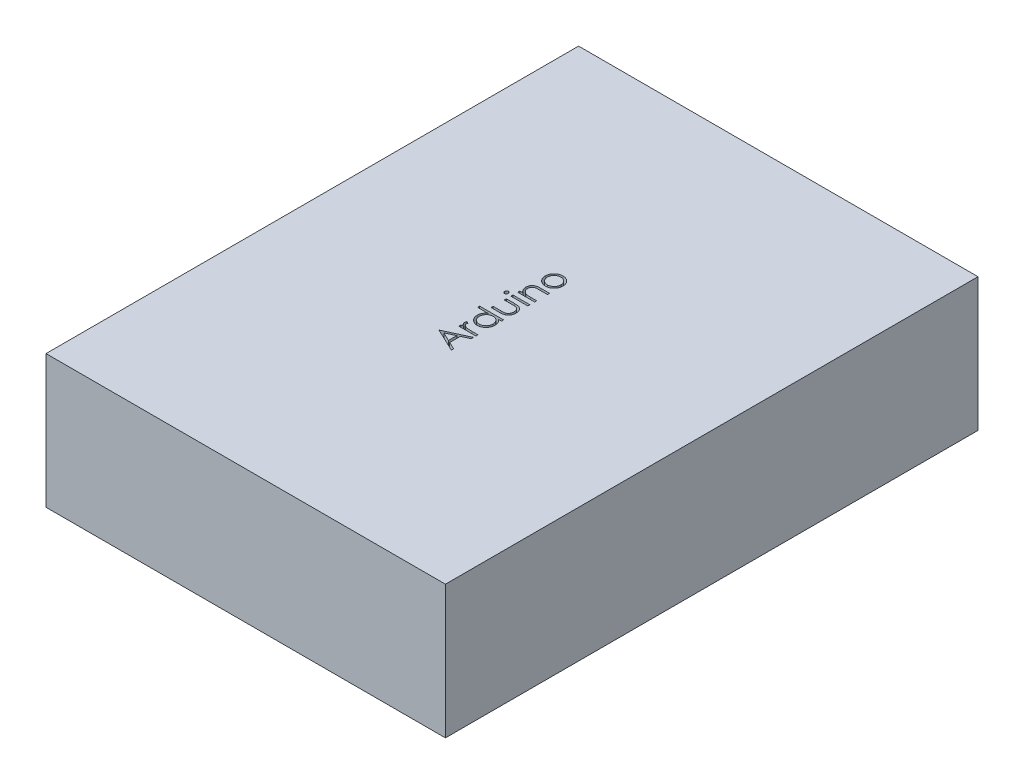
from build123d import *

# Parameters (mm, degrees)
SKETCH1_W           = 60
SKETCH1_H           = 80
BOSS_EXTRUDE1_DEPTH = 20
SKETCH2_W           = 2.557692308
SKETCH2_H           = 0.314102564
CUT_EXTRUDE1_DEPTH  = 2


with BuildPart() as part:
    # Sketch1 → Boss-Extrude1 (new body)
    with BuildSketch(Plane(origin=(0, 0, 0), x_dir=(1, 0, 0), z_dir=(0, 1, 0))):
        Rectangle(SKETCH1_W, SKETCH1_H)
    extrude(amount=BOSS_EXTRUDE1_DEPTH)

    # Sketch2 → Cut-Extrude1 (cut)
    # profile 1 of 8: a face of its own
    with BuildSketch(Plane(origin=(0, 20, 0), x_dir=(1, 0, 0), z_dir=(0, 1, 0))):
        Polygon((-3.5, -7.403846154), (0, -5.788461538), (0, -6.129907853), (-1.121794872, -6.647335737), (-1.121794872, -8.233974359), (0, -8.766125801), (0, -9.108974359), (-3.5, -7.448717949), align=None)
        Polygon((-2.817808494, -7.42978766), (-1.480769231, -8.063601763), (-1.480769231, -6.812800481), align=None, mode=Mode.SUBTRACT)
    # profile 2 of 8: a face of its own
    with BuildSketch(Plane(origin=(0, 20, 0), x_dir=(1, 0, 0), z_dir=(0, 1, 0))):
        with BuildLine():
            Line((-2.557692308, -5.429487179), (-2.557692308, -5.115384615))
            Line((-2.557692308, -5.115384615), (-2.181189904, -5.115384615))
            add(Edge.make_bspline(
                [(-2.181189904, -5.115384615), (-2.216261426, -5.092210694), (-2.283335439, -5.047890749), (-2.371926058, -4.973880931), (-2.446113212, -4.898881357), (-2.504482141, -4.820922676), (-2.548594798, -4.74076921), (-2.57959138, -4.659096853), (-2.598813304, -4.575705887), (-2.601312162, -4.519530425), (-2.602564103, -4.491386218)],
                knots=[0, 0, 0, 0, 1.280091057, 2.448164201, 3.510831157, 4.48793739, 5.405868014, 6.289422536, 7.142991551, 8, 8, 8, 8], degree=3))
            add(Edge.make_bspline(
                [(-2.602564103, -4.491386218), (-2.601373576, -4.469559891), (-2.59892399, -4.424650806), (-2.581713165, -4.356668216), (-2.554235143, -4.286624765), (-2.52839492, -4.241482377), (-2.514923878, -4.217948718)],
                knots=[0, 0, 0, 0, 0.901110191, 1.854092781, 2.881294221, 4, 4, 4, 4], degree=3))
            Line((-2.514923878, -4.217948718), (-2.242888622, -4.390424679))
            add(Edge.make_bspline(
                [(-2.242888622, -4.390424679), (-2.249628888, -4.405533701), (-2.262423203, -4.434213515), (-2.277565213, -4.476168081), (-2.286481129, -4.514849418), (-2.287831847, -4.539492977), (-2.288461538, -4.550981571)],
                knots=[0, 0, 0, 0, 1.180555205, 2.24091978, 3.179933427, 4, 4, 4, 4], degree=3))
            add(Edge.make_bspline(
                [(-2.288461538, -4.550981571), (-2.286794658, -4.576194872), (-2.283394705, -4.627622697), (-2.256284039, -4.702874031), (-2.213741221, -4.776549406), (-2.165297528, -4.83449764), (-2.118763125, -4.879524504), (-2.078035261, -4.911906683), (-2.031944456, -4.94097017), (-1.982272224, -4.969162524), (-1.927771932, -4.99535535), (-1.868354671, -5.018762487), (-1.804511084, -5.040652667), (-1.76011915, -5.052980207), (-1.737379808, -5.059294872)],
                knots=[0, 0, 0, 0, 1.125322384, 2.295331465, 3.535939348, 4.916963136, 5.656144286, 6.429838446, 7.238666481, 8.090384391, 8.983239461, 9.940052224, 10.944811494, 12, 12, 12, 12], degree=3))
            add(Edge.make_bspline(
                [(-1.737379808, -5.059294872), (-1.717103757, -5.064035444), (-1.671968634, -5.074588105), (-1.596591234, -5.084574498), (-1.507592607, -5.094838882), (-1.404869363, -5.101848422), (-1.288026631, -5.108469868), (-1.157568472, -5.112127827), (-1.013136318, -5.115268232), (-0.912395458, -5.115344583), (-0.859575321, -5.115384615)],
                knots=[0, 0, 0, 0, 0.566841273, 1.261806378, 2.068780918, 3.007109044, 4.065315289, 5.256255371, 6.561408263, 8, 8, 8, 8], degree=3))
            Line((-0.859575321, -5.115384615), (0, -5.115384615))
            Line((0, -5.115384615), (0, -5.429487179))
            Line((0, -5.429487179), (-2.557692308, -5.429487179))
        make_face()
    # profile 3 of 8: a face of its own
    with BuildSketch(Plane(origin=(0, 20, 0), x_dir=(1, 0, 0), z_dir=(0, 1, 0))):
        with BuildLine():
            Line((-3.58974359, -1.256410256), (0, -1.256410256))
            Line((0, -1.256410256), (0, -1.570512821))
            Line((0, -1.570512821), (-0.442407853, -1.570512821))
            add(Edge.make_bspline(
                [(-0.442407853, -1.570512821), (-0.402434233, -1.605986906), (-0.324309204, -1.675317979), (-0.22130842, -1.790022795), (-0.137906052, -1.913121366), (-0.069567916, -2.041524787), (-0.018442034, -2.176490803), (0.017961997, -2.317313988), (0.041350966, -2.464128882), (0.043687656, -2.564380754), (0.044871795, -2.615184295)],
                knots=[0, 0, 0, 0, 1.074325654, 2.099677833, 3.090439787, 4.057542011, 5.018572219, 5.985274637, 6.979019747, 8, 8, 8, 8], degree=3))
            add(Edge.make_bspline(
                [(0.044871795, -2.615184295), (0.043645423, -2.660352249), (0.041226962, -2.749425454), (0.022464659, -2.880454531), (-0.007665963, -3.00654678), (-0.049566853, -3.127821353), (-0.105147674, -3.243493498), (-0.171688922, -3.354553595), (-0.250929752, -3.460426287), (-0.341517781, -3.559497826), (-0.439912768, -3.650729826), (-0.544858315, -3.730791099), (-0.655900619, -3.797544179), (-0.771633773, -3.853364259), (-0.892948692, -3.896360604), (-1.01942586, -3.926334238), (-1.150915734, -3.945074685), (-1.240455257, -3.947492146), (-1.285857372, -3.948717949)],
                knots=[0, 0, 0, 0, 1.033919861, 2.038935746, 3.024066025, 3.998881131, 4.97069526, 5.957263378, 6.95902576, 7.993208707, 9.027059324, 10.027763471, 11.009749337, 11.988697705, 12.965288445, 13.950418724, 14.960734635, 16, 16, 16, 16], degree=3))
            add(Edge.make_bspline(
                [(-1.285857372, -3.948717949), (-1.330321075, -3.947464977), (-1.418223419, -3.94498792), (-1.547502117, -3.926534701), (-1.672020377, -3.895503692), (-1.791377321, -3.851955844), (-1.905717371, -3.796113889), (-2.015121396, -3.728185802), (-2.119890793, -3.648166678), (-2.21756202, -3.555914271), (-2.307782634, -3.4559795), (-2.38619168, -3.34907077), (-2.453908529, -3.237847488), (-2.507562005, -3.120584478), (-2.550971109, -2.999017373), (-2.581004078, -2.872063927), (-2.598701399, -2.740252348), (-2.601264163, -2.650761856), (-2.602564103, -2.60536859)],
                knots=[0, 0, 0, 0, 1.020392517, 2.01726096, 2.990465484, 3.961182959, 4.928053699, 5.906110375, 6.912531644, 7.948652711, 8.985773172, 9.998621852, 10.987621588, 11.969261332, 12.953316658, 13.946091881, 14.958173133, 16, 16, 16, 16], degree=3))
            add(Edge.make_bspline(
                [(-2.602564103, -2.60536859), (-2.601016985, -2.553146128), (-2.597980165, -2.45063924), (-2.572001775, -2.300887562), (-2.529910723, -2.158867188), (-2.470730835, -2.024274633), (-2.393055208, -1.898290135), (-2.300458108, -1.778821929), (-2.189067774, -1.668878831), (-2.105465017, -1.603801396), (-2.062700321, -1.570512821)],
                knots=[0, 0, 0, 0, 1.030935089, 2.023611011, 2.991955418, 3.950956655, 4.918431382, 5.908366361, 6.930082213, 8, 8, 8, 8], degree=3))
            Line((-2.062700321, -1.570512821), (-3.58974359, -1.570512821))
            Line((-3.58974359, -1.570512821), (-3.58974359, -1.256410256))
        make_face()
        with BuildLine():
            add(Edge.make_bspline(
                [(-2.288461538, -2.601161859), (-2.286826503, -2.647075209), (-2.283599202, -2.737700858), (-2.258445926, -2.87075915), (-2.216485352, -2.998018867), (-2.159435035, -3.119282119), (-2.086337296, -3.231167402), (-2.000214663, -3.332916839), (-1.899613419, -3.421393097), (-1.788133794, -3.497482466), (-1.667961498, -3.558565213), (-1.542380577, -3.601789482), (-1.413564365, -3.630243953), (-1.326203179, -3.633154447), (-1.282351763, -3.634615385)],
                knots=[0, 0, 0, 0, 1.031130969, 2.035288524, 3.029955243, 4.035265425, 5.037320146, 6.024362013, 7.021230137, 8.037832003, 9.049975902, 10.039737725, 11.016035826, 12, 12, 12, 12], degree=3))
            add(Edge.make_bspline(
                [(-1.282351763, -3.634615385), (-1.238764409, -3.632742965), (-1.151760548, -3.629005466), (-1.022955393, -3.602412472), (-0.897656365, -3.557212948), (-0.776518381, -3.496212798), (-0.663949475, -3.419227915), (-0.561541317, -3.330835803), (-0.474071536, -3.228596824), (-0.400797577, -3.115711215), (-0.341644806, -2.995092017), (-0.300476607, -2.868261032), (-0.273899498, -2.737584621), (-0.27079493, -2.648732392), (-0.269230769, -2.603966346)],
                knots=[0, 0, 0, 0, 0.979154007, 1.954470061, 2.941101473, 3.965068436, 4.993389179, 5.998216918, 6.996159742, 8.005560442, 9.015493761, 10.005250788, 10.994993882, 12, 12, 12, 12], degree=3))
            add(Edge.make_bspline(
                [(-0.269230769, -2.603966346), (-0.27090991, -2.558526036), (-0.274249554, -2.468149765), (-0.299260521, -2.334548138), (-0.342149827, -2.205338176), (-0.399788619, -2.081401295), (-0.471579217, -1.966056522), (-0.555626614, -1.862883895), (-0.652700961, -1.774611773), (-0.760626239, -1.701118773), (-0.878190217, -1.642835232), (-1.00322951, -1.600219053), (-1.135997919, -1.575302503), (-1.226858223, -1.572131457), (-1.273237179, -1.570512821)],
                knots=[0, 0, 0, 0, 1.01787422, 2.024450869, 3.03297362, 4.061474925, 5.080076323, 6.069755756, 7.033548292, 8.009625779, 8.9862229, 9.964937832, 10.961217871, 12, 12, 12, 12], degree=3))
            add(Edge.make_bspline(
                [(-1.273237179, -1.570512821), (-1.30857501, -1.571472477), (-1.378131043, -1.573361384), (-1.480258561, -1.587791954), (-1.577992287, -1.61074688), (-1.671434976, -1.64309305), (-1.760069991, -1.685584335), (-1.844533752, -1.736832101), (-1.924386963, -1.79773755), (-1.998530034, -1.867320246), (-2.066156496, -1.943485449), (-2.126520737, -2.02407999), (-2.17610951, -2.110058737), (-2.217150781, -2.199975773), (-2.249809931, -2.293987108), (-2.271597625, -2.392857728), (-2.286557946, -2.495536715), (-2.287820327, -2.56558277), (-2.288461538, -2.601161859)],
                knots=[0, 0, 0, 0, 1.050140795, 2.067009409, 3.05949893, 4.030605086, 5.00011959, 5.97591094, 6.962425594, 7.979863591, 8.993523472, 9.986985069, 10.967611495, 11.937549037, 12.921786183, 13.919465291, 14.943216303, 16, 16, 16, 16], degree=3))
        make_face(mode=Mode.SUBTRACT)
    # profile 4 of 8: a face of its own
    with BuildSketch(Plane(origin=(0, 20, 0), x_dir=(1, 0, 0), z_dir=(0, 1, 0))):
        with BuildLine():
            Line((-2.557692308, -0.583333333), (-2.557692308, -0.269230769))
            Line((-2.557692308, -0.269230769), (-1.371394231, -0.269230769))
            add(Edge.make_bspline(
                [(-1.371394231, -0.269230769), (-1.336571482, -0.269088864), (-1.269957194, -0.268817407), (-1.174102007, -0.266976466), (-1.086685294, -0.262646372), (-1.007656557, -0.257232548), (-0.937029166, -0.250270412), (-0.875049809, -0.241987051), (-0.821015625, -0.23272863), (-0.788472269, -0.223665916), (-0.77333734, -0.219451122)],
                knots=[0, 0, 0, 0, 1.388932606, 2.656963016, 3.823490214, 4.879454478, 5.816252168, 6.653371382, 7.373723809, 8, 8, 8, 8], degree=3))
            add(Edge.make_bspline(
                [(-0.77333734, -0.219451122), (-0.754314469, -0.212689667), (-0.716664208, -0.199307326), (-0.662275202, -0.175033842), (-0.61189992, -0.145005505), (-0.563595847, -0.112145678), (-0.51879386, -0.07424627), (-0.477569617, -0.031786799), (-0.438365526, 0.013811438), (-0.391980734, 0.081566462), (-0.342265403, 0.174225728), (-0.299369585, 0.295878483), (-0.273733765, 0.427782709), (-0.27075951, 0.518947428), (-0.269230769, 0.565805288)],
                knots=[0, 0, 0, 0, 0.725840625, 1.436591201, 2.137033971, 2.831655856, 3.53531722, 4.242432219, 4.957935707, 5.694543706, 7.190802206, 8.724350549, 10.316345118, 12, 12, 12, 12], degree=3))
            add(Edge.make_bspline(
                [(-0.269230769, 0.565805288), (-0.270792018, 0.612658796), (-0.273812745, 0.703311664), (-0.298596284, 0.833766634), (-0.340001973, 0.953018048), (-0.397809384, 1.059868999), (-0.468551447, 1.15383484), (-0.551560256, 1.232139258), (-0.644209643, 1.296746513), (-0.713333922, 1.324955934), (-0.748096955, 1.339142628)],
                knots=[0, 0, 0, 0, 1.157059328, 2.238695713, 3.266970494, 4.264342957, 5.228770407, 6.160125903, 7.074715775, 8, 8, 8, 8], degree=3))
            add(Edge.make_bspline(
                [(-0.748096955, 1.339142628), (-0.762063254, 1.343336858), (-0.792939329, 1.352609277), (-0.845319078, 1.362571628), (-0.907783682, 1.37154609), (-0.980741891, 1.379209266), (-1.064003043, 1.384674428), (-1.157541119, 1.387620455), (-1.26106248, 1.39094873), (-1.333530239, 1.390999247), (-1.371394231, 1.391025641)],
                knots=[0, 0, 0, 0, 0.557542046, 1.232589297, 2.036731608, 2.971723315, 4.038036528, 5.22795436, 6.551621927, 8, 8, 8, 8], degree=3))
            Line((-1.371394231, 1.391025641), (-2.557692308, 1.391025641))
            Line((-2.557692308, 1.391025641), (-2.557692308, 1.705128205))
            Line((-2.557692308, 1.705128205), (-1.3125, 1.705128205))
            add(Edge.make_bspline(
                [(-1.3125, 1.705128205), (-1.270193064, 1.704684923), (-1.188111822, 1.703824896), (-1.068824502, 1.698339141), (-0.957442487, 1.688795546), (-0.854306526, 1.674684128), (-0.759392664, 1.657564268), (-0.672668679, 1.63591862), (-0.594021821, 1.609926915), (-0.522278152, 1.580625834), (-0.457236046, 1.545998707), (-0.395483334, 1.509188137), (-0.338652658, 1.466603316), (-0.283669926, 1.422158877), (-0.234378406, 1.371557293), (-0.186871763, 1.318691323), (-0.144191351, 1.260654311), (-0.104921928, 1.199130861), (-0.069707159, 1.133541491), (-0.038720643, 1.064045788), (-0.012916197, 0.990363795), (0.008115437, 0.912522726), (0.024914963, 0.830825327), (0.036677563, 0.745105915), (0.043909547, 0.655441597), (0.04454566, 0.594331815), (0.044871795, 0.563000801)],
                knots=[0, 0, 0, 0, 1.493202592, 2.897017285, 4.213619731, 5.437335819, 6.569830554, 7.616136122, 8.589086983, 9.491357706, 10.347307, 11.187612773, 12.025729508, 12.851620453, 13.679855991, 14.515574443, 15.358588344, 16.218977568, 17.089938093, 17.983570823, 18.901874366, 19.842360053, 20.827541903, 21.843594624, 22.894409941, 24, 24, 24, 24], degree=3))
            add(Edge.make_bspline(
                [(0.044871795, 0.563000801), (0.044532563, 0.531904122), (0.043865941, 0.470796251), (0.036717408, 0.38112735), (0.024933365, 0.295170339), (0.007992445, 0.213279792), (-0.01276337, 0.135125645), (-0.038879827, 0.061087328), (-0.069703446, -0.008928653), (-0.104768555, -0.075072944), (-0.144263669, -0.137126097), (-0.187732462, -0.194948642), (-0.234040785, -0.249571403), (-0.284767972, -0.299478125), (-0.339534233, -0.345034853), (-0.398093467, -0.38643909), (-0.45978383, -0.424399011), (-0.525848019, -0.458750915), (-0.598419733, -0.488262926), (-0.678716919, -0.514318095), (-0.767619409, -0.535628757), (-0.865051346, -0.552971218), (-0.970546385, -0.566922661), (-1.084714801, -0.576608803), (-1.207278493, -0.582024634), (-1.291928383, -0.582887695), (-1.335637019, -0.583333333)],
                knots=[0, 0, 0, 0, 1.083759936, 2.129689164, 3.133164553, 4.10615121, 5.04285688, 5.949793092, 6.839814394, 7.707177441, 8.556916231, 9.400895077, 10.227072161, 11.05083587, 11.877976332, 12.707560346, 13.548664154, 14.401248865, 15.299878211, 16.27626931, 17.341250723, 18.483766318, 19.724630785, 21.049282549, 22.476408703, 24, 24, 24, 24], degree=3))
            Line((-1.335637019, -0.583333333), (-2.557692308, -0.583333333))
        make_face()
    # profile 5 of 8: a face of its own
    with BuildSketch(Plane(origin=(0, 20, 0), x_dir=(1, 0, 0), z_dir=(0, 1, 0))):
        with BuildLine():
            add(Edge.make_bspline(
                [(-3.634615385, 2.533854167), (-3.633711232, 2.553345482), (-3.631940728, 2.591513222), (-3.616779251, 2.64670649), (-3.591079566, 2.696963502), (-3.556599885, 2.741541235), (-3.516050441, 2.779793122), (-3.468789473, 2.806573832), (-3.417730834, 2.823786228), (-3.382115745, 2.825864783), (-3.363982372, 2.826923077)],
                knots=[0, 0, 0, 0, 1.055194115, 2.066272739, 3.074728998, 4.095836921, 5.109056067, 6.073838105, 7.019297344, 8, 8, 8, 8], degree=3))
            add(Edge.make_bspline(
                [(-3.363982372, 2.826923077), (-3.346319719, 2.825840917), (-3.311402744, 2.823701615), (-3.261229272, 2.806587127), (-3.214624988, 2.779564889), (-3.174154278, 2.741565763), (-3.139693658, 2.696957002), (-3.113988919, 2.646708217), (-3.098828782, 2.591512768), (-3.097058093, 2.553345329), (-3.096153846, 2.533854167)],
                knots=[0, 0, 0, 0, 0.96129708, 1.900370562, 2.859976407, 3.87933698, 4.906634145, 5.921202961, 6.938410037, 8, 8, 8, 8], degree=3))
            add(Edge.make_bspline(
                [(-3.096153846, 2.533854167), (-3.097023566, 2.514585891), (-3.098716363, 2.477082711), (-3.114286381, 2.422715869), (-3.139702454, 2.37288738), (-3.173928639, 2.328222707), (-3.214873536, 2.290992514), (-3.26120083, 2.263894188), (-3.311409985, 2.246819227), (-3.346322151, 2.244674598), (-3.363982372, 2.243589744)],
                knots=[0, 0, 0, 0, 1.054934014, 2.053291228, 3.073705704, 4.106921865, 5.123545215, 6.088680038, 7.033164197, 8, 8, 8, 8], degree=3))
            add(Edge.make_bspline(
                [(-3.363982372, 2.243589744), (-3.382113221, 2.24465083), (-3.417723354, 2.246734871), (-3.468818387, 2.263906987), (-3.515799889, 2.290766795), (-3.556825388, 2.328247359), (-3.591070823, 2.372880819), (-3.616481804, 2.422717564), (-3.632053144, 2.477082264), (-3.633745758, 2.51458574), (-3.634615385, 2.533854167)],
                knots=[0, 0, 0, 0, 0.98631895, 1.937192651, 2.907499808, 3.917963147, 4.944918757, 5.95915025, 6.951458133, 8, 8, 8, 8], degree=3))
        make_face()
    # profile 6 of 8: a face of its own
    with BuildSketch(Plane(origin=(0, 20, 0), x_dir=(1, 0, 0), z_dir=(0, 1, 0))):
        with Locations((-1.278846154, 2.53525641)):
            Rectangle(SKETCH2_W, SKETCH2_H)
    # profile 7 of 8: a face of its own
    with BuildSketch(Plane(origin=(0, 20, 0), x_dir=(1, 0, 0), z_dir=(0, 1, 0))):
        with BuildLine():
            Line((-2.557692308, 3.41025641), (-2.557692308, 3.724358974))
            Line((-2.557692308, 3.724358974), (-2.096354167, 3.724358974))
            add(Edge.make_bspline(
                [(-2.096354167, 3.724358974), (-2.138259455, 3.757838716), (-2.219450404, 3.822705279), (-2.325322597, 3.931841915), (-2.414166302, 4.045638956), (-2.484117946, 4.165944646), (-2.537022548, 4.291521012), (-2.575173001, 4.422011735), (-2.598061986, 4.558123097), (-2.60105165, 4.65068799), (-2.602564103, 4.697516026)],
                knots=[0, 0, 0, 0, 1.127869841, 2.185233117, 3.191641716, 4.159226741, 5.10472073, 6.052603964, 7.014823782, 8, 8, 8, 8], degree=3))
            add(Edge.make_bspline(
                [(-2.602564103, 4.697516026), (-2.600920109, 4.744870536), (-2.597700803, 4.837601196), (-2.569252618, 4.972108818), (-2.524495803, 5.098503536), (-2.460946021, 5.21492231), (-2.382464341, 5.320116276), (-2.290894531, 5.412171578), (-2.186120249, 5.488933055), (-2.088348776, 5.54024124), (-2.001464733, 5.573396974), (-1.927156305, 5.595190478), (-1.844332361, 5.612820471), (-1.75319979, 5.628618099), (-1.65339191, 5.639156736), (-1.545147134, 5.647510604), (-1.428484143, 5.653485884), (-1.347797639, 5.65372358), (-1.306189904, 5.653846154)],
                knots=[0, 0, 0, 0, 1.235846195, 2.420061613, 3.574938557, 4.72781258, 5.870749808, 6.993217613, 8.10690044, 9.251157787, 9.865716151, 10.534141144, 11.271861846, 12.076851687, 12.949307443, 13.892392281, 14.913166647, 16, 16, 16, 16], degree=3))
            Line((-1.306189904, 5.653846154), (0, 5.653846154))
            Line((0, 5.653846154), (0, 5.33974359))
            Line((0, 5.33974359), (-1.203125, 5.33974359))
            add(Edge.make_bspline(
                [(-1.203125, 5.33974359), (-1.237947495, 5.339551181), (-1.304557001, 5.339183137), (-1.399925376, 5.338007114), (-1.486180825, 5.335238811), (-1.563571239, 5.331188903), (-1.631813366, 5.325520055), (-1.691252631, 5.31945145), (-1.741362537, 5.312091125), (-1.77152758, 5.305527713), (-1.78505609, 5.302584135)],
                knots=[0, 0, 0, 0, 1.430803381, 2.736883362, 3.918614142, 4.976458302, 5.92063272, 6.731858525, 7.431260095, 8, 8, 8, 8], degree=3))
            add(Edge.make_bspline(
                [(-1.78505609, 5.302584135), (-1.824795804, 5.292011346), (-1.901079039, 5.27171612), (-2.004374389, 5.220546103), (-2.093030698, 5.157428435), (-2.165224631, 5.079227091), (-2.221425751, 4.988042367), (-2.260391137, 4.883722676), (-2.284769891, 4.767347674), (-2.287196662, 4.685492763), (-2.288461538, 4.642828526)],
                knots=[0, 0, 0, 0, 1.084232, 2.08126119, 3.027460722, 3.945137793, 4.874029258, 5.839697328, 6.874011781, 8, 8, 8, 8], degree=3))
            add(Edge.make_bspline(
                [(-2.288461538, 4.642828526), (-2.287992381, 4.617558596), (-2.287063931, 4.567550059), (-2.27751279, 4.493432833), (-2.262414052, 4.421318617), (-2.240162758, 4.351371584), (-2.212851267, 4.28336472), (-2.179994601, 4.216820697), (-2.13954707, 4.153275158), (-2.094328751, 4.091682428), (-2.044256989, 4.034366753), (-1.991410553, 3.981039156), (-1.935135453, 3.933500942), (-1.876335372, 3.890432318), (-1.81420357, 3.853254041), (-1.749339254, 3.820800957), (-1.681657107, 3.793265261), (-1.634682046, 3.779582568), (-1.611177885, 3.772736378)],
                knots=[0, 0, 0, 0, 1.023827899, 2.026128959, 3.023898047, 4.006668367, 4.997079741, 5.992687789, 7.009920206, 8.046337072, 9.087246971, 10.092051999, 11.086713115, 12.070168086, 13.043348831, 14.017773728, 15.008185103, 16, 16, 16, 16], degree=3))
            add(Edge.make_bspline(
                [(-1.611177885, 3.772736378), (-1.593922682, 3.76879673), (-1.556359007, 3.760220321), (-1.494714588, 3.750957141), (-1.423404613, 3.742549566), (-1.342512296, 3.735512607), (-1.251754421, 3.73120719), (-1.151518583, 3.726512794), (-1.041405094, 3.724803733), (-0.964743402, 3.724511379), (-0.924779647, 3.724358974)],
                knots=[0, 0, 0, 0, 0.615963638, 1.340920617, 2.168419149, 3.115676021, 4.16674242, 5.331190069, 6.6087489, 8, 8, 8, 8], degree=3))
            Line((-0.924779647, 3.724358974), (0, 3.724358974))
            Line((0, 3.724358974), (0, 3.41025641))
            Line((0, 3.41025641), (-2.557692308, 3.41025641))
        make_face()
    # profile 8 of 8: a face of its own
    with BuildSketch(Plane(origin=(0, 20, 0), x_dir=(1, 0, 0), z_dir=(0, 1, 0))):
        with BuildLine():
            add(Edge.make_bspline(
                [(-2.602564103, 7.607171474), (-2.601542211, 7.655162747), (-2.599538533, 7.749261905), (-2.578123567, 7.887069791), (-2.545376203, 8.018614927), (-2.500104641, 8.144401119), (-2.43942269, 8.262817414), (-2.367013399, 8.375588658), (-2.281230805, 8.482405667), (-2.214872737, 8.546428696), (-2.181189904, 8.578926282)],
                knots=[0, 0, 0, 0, 1.054011418, 2.066658804, 3.057071809, 4.030435133, 4.997543892, 5.974964718, 6.972108034, 8, 8, 8, 8], degree=3))
            add(Edge.make_bspline(
                [(-2.181189904, 8.578926282), (-2.148975918, 8.606908236), (-2.085171376, 8.662330616), (-1.981715763, 8.733396335), (-1.874575662, 8.794617895), (-1.762328336, 8.843680856), (-1.645953664, 8.88236588), (-1.525051653, 8.909831576), (-1.399889306, 8.926168511), (-1.314885468, 8.928371478), (-1.271834936, 8.929487179)],
                knots=[0, 0, 0, 0, 1.025258237, 2.030674902, 3.01204498, 3.988269485, 4.97094183, 5.956517959, 6.965070386, 8, 8, 8, 8], degree=3))
            add(Edge.make_bspline(
                [(-1.271834936, 8.929487179), (-1.228534878, 8.928505842), (-1.142971945, 8.926566674), (-1.016952579, 8.908223057), (-0.894757756, 8.879691972), (-0.776899063, 8.838860133), (-0.663016235, 8.786502024), (-0.553606686, 8.722611337), (-0.448454553, 8.646739719), (-0.348452714, 8.560735723), (-0.2562865, 8.465683847), (-0.17595823, 8.362567698), (-0.107136706, 8.253413664), (-0.05170029, 8.136770311), (-0.00799059, 8.013702824), (0.022709427, 7.883945756), (0.04127111, 7.747700686), (0.043654684, 7.654673465), (0.044871795, 7.607171474)],
                knots=[0, 0, 0, 0, 0.998656419, 1.973391657, 2.932242238, 3.890759089, 4.846373663, 5.82037756, 6.809684879, 7.83454468, 8.860553229, 9.859544525, 10.845671541, 11.83227036, 12.833544569, 13.85385346, 14.904124723, 16, 16, 16, 16], degree=3))
            add(Edge.make_bspline(
                [(0.044871795, 7.607171474), (0.043650599, 7.559436755), (0.041258824, 7.465945895), (0.022781541, 7.329219913), (-0.007976441, 7.199230294), (-0.051843934, 7.076001696), (-0.107138478, 6.958856849), (-0.175750167, 6.849070352), (-0.256310322, 6.745870436), (-0.348446259, 6.650798452), (-0.448456216, 6.564799847), (-0.553606254, 6.488926838), (-0.663016348, 6.425036512), (-0.776899033, 6.372678308), (-0.894757764, 6.331846495), (-1.016952577, 6.303315403), (-1.142971945, 6.284971788), (-1.228534878, 6.283032619), (-1.271834936, 6.282051282)],
                knots=[0, 0, 0, 0, 1.099876186, 2.154163076, 3.173186993, 4.173200201, 5.163417411, 6.152872554, 7.150605724, 8.17532212, 9.198891216, 10.186952605, 11.159729845, 12.11414092, 13.071450619, 14.029093627, 15.002601286, 16, 16, 16, 16], degree=3))
            add(Edge.make_bspline(
                [(-1.271834936, 6.282051282), (-1.314652437, 6.283171924), (-1.399423731, 6.285390601), (-1.52433693, 6.301749831), (-1.644868911, 6.32891668), (-1.760608083, 6.368137988), (-1.872585626, 6.417109873), (-1.98011856, 6.477715265), (-2.083122115, 6.549468426), (-2.146842045, 6.604675491), (-2.179086538, 6.632612179)],
                knots=[0, 0, 0, 0, 1.031377469, 2.041950136, 3.029500481, 4.003457997, 4.981637986, 5.969878303, 6.97268806, 8, 8, 8, 8], degree=3))
            add(Edge.make_bspline(
                [(-2.179086538, 6.632612179), (-2.213061478, 6.665060771), (-2.279879174, 6.728876634), (-2.365411698, 6.836225362), (-2.439327772, 6.948719183), (-2.498803987, 7.068444109), (-2.545642505, 7.194126967), (-2.57820802, 7.32634621), (-2.599461375, 7.464621725), (-2.601519553, 7.559181346), (-2.602564103, 7.607171474)],
                knots=[0, 0, 0, 0, 1.027980169, 2.021703884, 2.998553061, 3.971491411, 4.943284454, 5.930300938, 6.949603206, 8, 8, 8, 8], degree=3))
        make_face()
        with BuildLine():
            add(Edge.make_bspline(
                [(-2.288461538, 7.605769231), (-2.287496947, 7.571831619), (-2.285592664, 7.504832491), (-2.271108759, 7.406212907), (-2.248161257, 7.311272749), (-2.215557194, 7.219831919), (-2.173458319, 7.132198694), (-2.121749868, 7.048289492), (-2.061117263, 6.967856277), (-1.99165323, 6.892477216), (-1.915779287, 6.823283762), (-1.834912684, 6.762846025), (-1.750292131, 6.711165251), (-1.66179029, 6.668893446), (-1.569105401, 6.636473973), (-1.47278329, 6.613500918), (-1.372533096, 6.598990492), (-1.304369985, 6.597109639), (-1.269731571, 6.596153846)],
                knots=[0, 0, 0, 0, 1.02155314, 2.01673505, 2.994700672, 3.958461264, 4.934171024, 5.916582427, 6.921469794, 7.962398674, 8.998583302, 10.009097305, 10.997513862, 11.97957236, 12.956600784, 13.948243505, 14.957359924, 16, 16, 16, 16], degree=3))
            add(Edge.make_bspline(
                [(-1.269731571, 6.596153846), (-1.224979543, 6.59776067), (-1.136155138, 6.600949914), (-1.005344015, 6.626885151), (-0.879762163, 6.670271431), (-0.760145777, 6.72885871), (-0.649473499, 6.802264929), (-0.550802015, 6.888751996), (-0.465616203, 6.987391696), (-0.394935358, 7.097008196), (-0.338775602, 7.215362514), (-0.298976626, 7.340618835), (-0.273104934, 7.471259529), (-0.270533459, 7.56054026), (-0.269230769, 7.605769231)],
                knots=[0, 0, 0, 0, 1.016792936, 2.018143844, 3.017858371, 4.030088057, 5.03801393, 6.028138512, 7.003788237, 7.991172063, 8.984598303, 9.972568034, 10.972917682, 12, 12, 12, 12], degree=3))
            add(Edge.make_bspline(
                [(-0.269230769, 7.605769231), (-0.270541049, 7.6509956), (-0.273127506, 7.740271196), (-0.298846326, 7.870730373), (-0.338949987, 7.995644344), (-0.394872197, 8.113875732), (-0.465884611, 8.223442335), (-0.550320988, 8.322791457), (-0.64973484, 8.408540068), (-0.760292369, 8.481873673), (-0.879576721, 8.541420415), (-1.005367193, 8.584603617), (-1.136149235, 8.610601203), (-1.224977566, 8.613782032), (-1.269731571, 8.615384615)],
                knots=[0, 0, 0, 0, 1.02726834, 2.027799167, 3.010890988, 4.004497153, 4.992059811, 5.971914811, 6.958719428, 7.966827853, 8.981595046, 9.981490638, 10.983022906, 12, 12, 12, 12], degree=3))
            add(Edge.make_bspline(
                [(-1.269731571, 8.615384615), (-1.304370192, 8.614429153), (-1.37253371, 8.612548948), (-1.472780943, 8.598033803), (-1.569113987, 8.575078174), (-1.661758671, 8.54259462), (-1.750521749, 8.500510583), (-1.834664636, 8.447836306), (-1.916059349, 8.387645422), (-1.991407949, 8.317617162), (-2.06114434, 8.242316777), (-2.12177338, 8.161850968), (-2.173231066, 8.078066188), (-2.215917283, 7.990687553), (-2.247864629, 7.899235), (-2.271241259, 7.804427867), (-2.285531456, 7.706229058), (-2.287478598, 7.639470015), (-2.288461538, 7.605769231)],
                knots=[0, 0, 0, 0, 1.042975879, 2.052417305, 3.044379404, 4.0217225, 5.00409729, 5.996508862, 7.007348322, 8.048612455, 9.089876587, 10.095087598, 11.077815406, 12.047498138, 13.018202342, 13.98964644, 14.985148868, 16, 16, 16, 16], degree=3))
        make_face(mode=Mode.SUBTRACT)
    extrude(amount=-CUT_EXTRUDE1_DEPTH, mode=Mode.SUBTRACT)


solid = part.part
